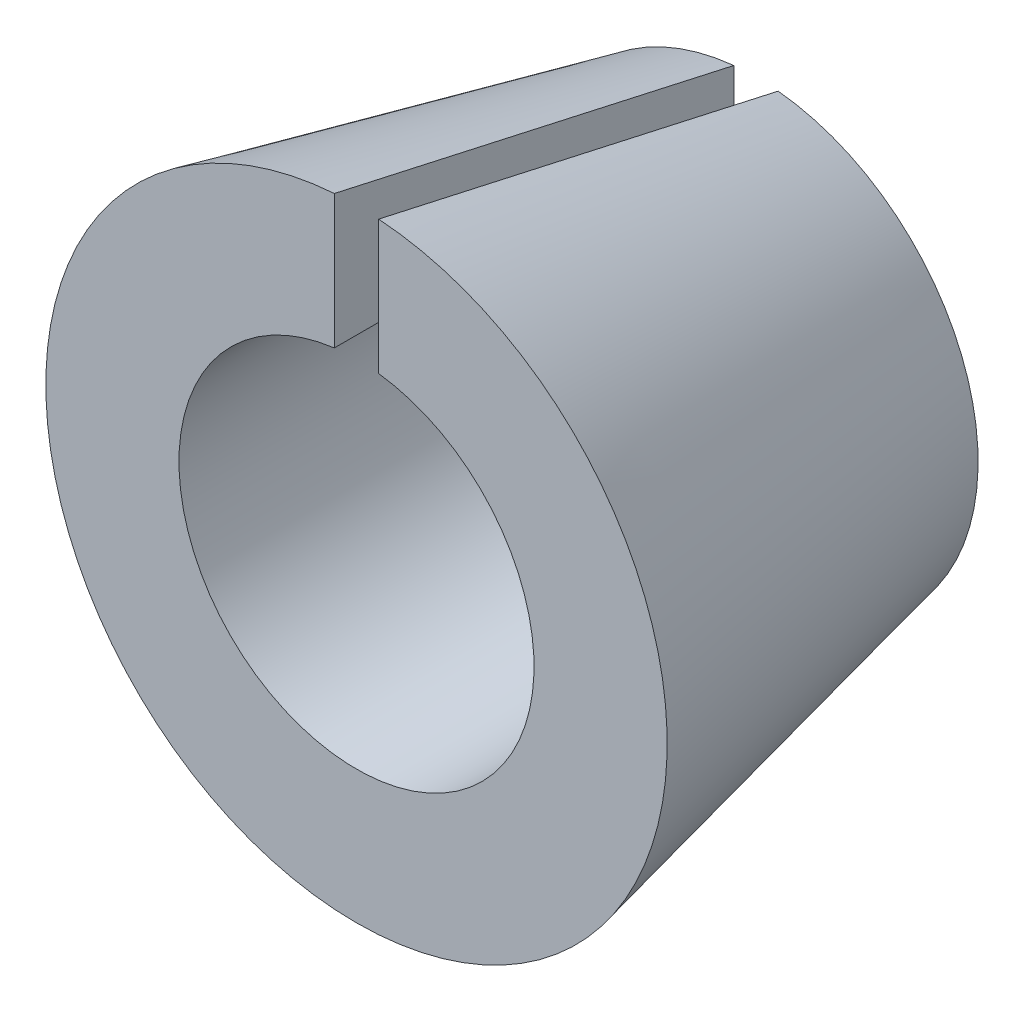
from build123d import *

# Parameters (mm, degrees)
ESQUISSE1_R             = 7
BASE_EXTRUSION_DEPTH    = 9
BASE_EXTRUSION_DRAFT    = -12.5
ENL_V_MAT_EXTRU_2_DEPTH = 14.37908816


with BuildPart() as part:
    # Esquisse1 → Base-Extrusion (with draft: the straight prism first)
    with BuildSketch(Plane.XY):
        Circle(ESQUISSE1_R)
    extrude(amount=-BASE_EXTRUSION_DEPTH)
    # Base-Extrusion: the draft: its side faces are tilted about the plane it starts from
    base_extrusion_sides = [part.faces().sort_by_distance(p)[0] for p in [
        (-7, 0, -4.5),
    ]]
    draft(base_extrusion_sides, Plane.XY, BASE_EXTRUSION_DRAFT)

    # Esquisse5 → Enlèv. mat.-Extru.2 (cut, through all)
    with BuildSketch(Plane.XY):
        with BuildLine():
            Line((-0.5, 7.599649669), (0.5, 7.599649669))
            Line((0.5, 7.599649669), (0.5, 3.968626967))
            ThreePointArc((0.5, 3.968626967), (0, -4), (-0.5, 3.968626967))
            Line((-0.5, 3.968626967), (-0.5, 7.599649669))
        make_face()
    extrude(amount=-ENL_V_MAT_EXTRU_2_DEPTH, mode=Mode.SUBTRACT)


solid = part.part
